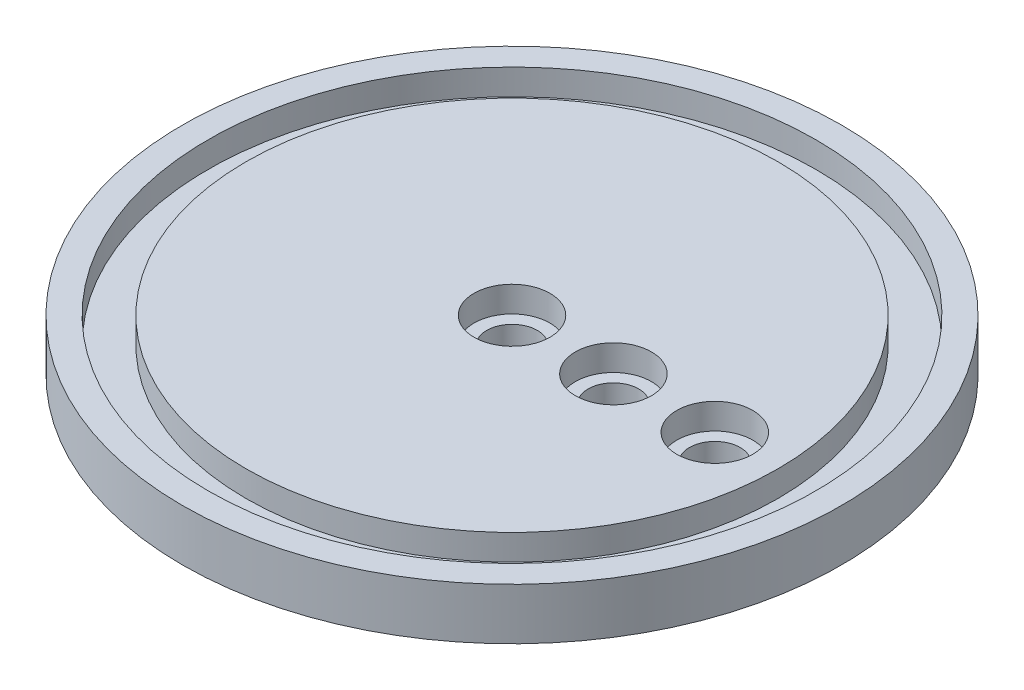
from build123d import *

# Parameters (mm, degrees)
SKETCH2_R           = 13
SKETCH2_R_2         = 1
BOSS_EXTRUDE2_DEPTH = 1.016
SKETCH3_R           = 13
SKETCH3_R_2         = 11.992
SKETCH3_R_3         = 10.492
SKETCH3_R_4         = 1.5
BOSS_EXTRUDE4_DEPTH = 1.016


with BuildPart() as part:
    # Sketch2 → Boss-Extrude2 (new body)
    with BuildSketch(Plane(origin=(0, 0, 0), x_dir=(1, 0, 0), z_dir=(0, 1, 0))):
        with Locations(Location((0, 0, 0), (0, 0, 270))):
            Circle(SKETCH2_R)
        with Locations(Location((0, 0, 0), (0, 0, 270))):
            Circle(SKETCH2_R_2, mode=Mode.SUBTRACT)
        with Locations(Location((4, 0, 0), (0, 0, 270))):
            Circle(SKETCH2_R_2, mode=Mode.SUBTRACT)
        with Locations(Location((8, 0, 0), (0, 0, 270))):
            Circle(SKETCH2_R_2, mode=Mode.SUBTRACT)
    extrude(amount=BOSS_EXTRUDE2_DEPTH)

    # Sketch3 → Boss-Extrude4 (add)
    # profile 1 of 2: a face of its own
    with BuildSketch(Plane(origin=(0, 1.016, 0), x_dir=(1, 0, 0), z_dir=(0, 1, 0))):
        with Locations(Location((0, 0, 0), (0, 0, 270))):
            Circle(SKETCH3_R)
        with Locations(Location((0, 0, 0), (0, 0, 270))):
            Circle(SKETCH3_R_2, mode=Mode.SUBTRACT)
    # profile 2 of 2: a face of its own
    with BuildSketch(Plane(origin=(0, 1.016, 0), x_dir=(1, 0, 0), z_dir=(0, 1, 0))):
        with Locations(Location((0, 0, 0), (0, 0, 270))):
            Circle(SKETCH3_R_3)
        with Locations(Location((0, 0, 0), (0, 0, 270))):
            Circle(SKETCH3_R_4, mode=Mode.SUBTRACT)
        with Locations(Location((4, 0, 0), (0, 0, 270))):
            Circle(SKETCH3_R_4, mode=Mode.SUBTRACT)
        with Locations(Location((8, 0, 0), (0, 0, 270))):
            Circle(SKETCH3_R_4, mode=Mode.SUBTRACT)
    extrude(amount=BOSS_EXTRUDE4_DEPTH)


solid = part.part
